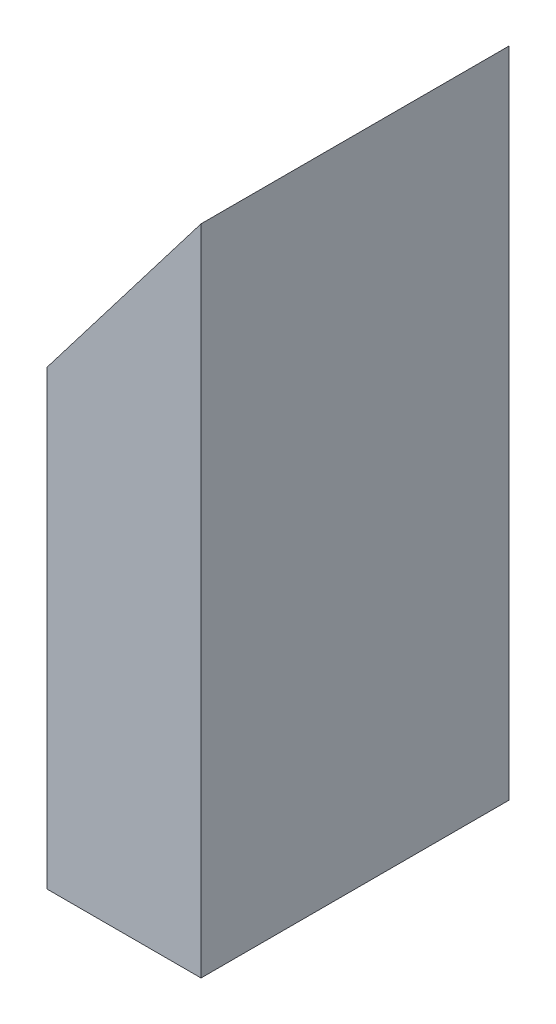
from build123d import *

# Parameters (mm, degrees)
EXTRUDE1_DEPTH              = 25.4
F_1_4_20_TAPPED_HOLE2_D     = 5.1054
F_1_4_20_TAPPED_HOLE2_DEPTH = 16.002
F_1_4_20_TAPPED_HOLE2_TIP   = 1.533816902


with BuildPart() as part:
    # Sketch1 → Extrude1 (new body)
    with BuildSketch(Plane.XY):
        Polygon((-8.815807595, 41.879239751), (-21.52120708, 25.279287896), (-21.52120708, -11.990787033), (-8.815807595, -11.990787033), align=None)
    extrude(amount=EXTRUDE1_DEPTH)

    # 1/4-20 Tapped Hole2
    with Locations(Plane(origin=(7.200348194, -11.990787033, 18.061260674), x_dir=(-1, 0, 0), z_dir=(0, -1, 0))):
        with Locations((22.929112651, 5.361260674)):
            Hole(F_1_4_20_TAPPED_HOLE2_D / 2, depth=F_1_4_20_TAPPED_HOLE2_DEPTH)
            with Locations((0, 0, -(F_1_4_20_TAPPED_HOLE2_DEPTH + F_1_4_20_TAPPED_HOLE2_TIP / 2))):  # 118° drill point
                Cone(0, F_1_4_20_TAPPED_HOLE2_D / 2, F_1_4_20_TAPPED_HOLE2_TIP, mode=Mode.SUBTRACT)


solid = part.part
